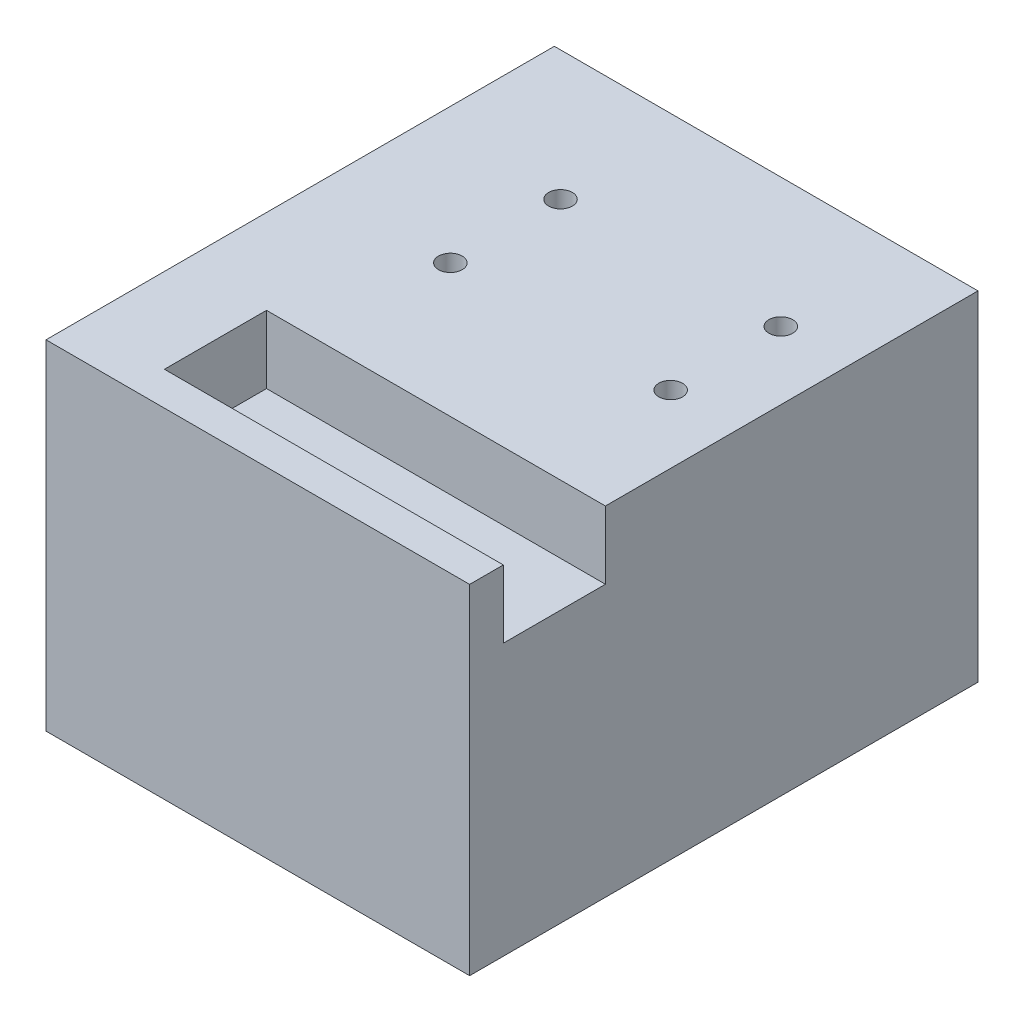
from build123d import *

# Parameters (mm, degrees)
SKETCH2_W           = 80
SKETCH2_H           = 100
BOSS_EXTRUDE1_DEPTH = 40
SKETCH3_W           = 40
SKETCH3_H           = 12.05
CUT_EXTRUDE1_DEPTH  = 8
SKETCH5_R           = 1.4
CUT_EXTRUDE2_DEPTH  = 2
SKETCH8_W           = 100
SKETCH8_H           = 40
CUT_EXTRUDE5_DEPTH  = 30
SKETCH9_W           = 50
SKETCH9_H           = 40
CUT_EXTRUDE6_DEPTH  = 40


with BuildPart() as part:
    # Sketch2 → Boss-Extrude1 (new body)
    with BuildSketch(Plane(origin=(0, 0, 0), x_dir=(1, 0, 0), z_dir=(0, 1, 0))):
        Rectangle(SKETCH2_W, SKETCH2_H)
    extrude(amount=BOSS_EXTRUDE1_DEPTH)

    # Sketch3 → Cut-Extrude1 (cut)
    with BuildSketch(Plane(origin=(0, 40, 0), x_dir=(1, 0, 0), z_dir=(0, 1, 0))):
        with Locations((20, 0)):
            Rectangle(SKETCH3_W, SKETCH3_H)
    extrude(amount=-CUT_EXTRUDE1_DEPTH, mode=Mode.SUBTRACT)

    # Sketch5 → Cut-Extrude2 (cut)
    with BuildSketch(Plane(origin=(0, 40, 0), x_dir=(1, 0, 0), z_dir=(0, 1, 0))):
        with Locations(Location((6, 21.725, 0), (0, 0, 270))):
            Circle(SKETCH5_R)
        with Locations(Location((32, 21.725, 0), (0, 0, 270))):
            Circle(SKETCH5_R)
        with Locations(Location((32, 34.725, 0), (0, 0, 270))):
            Circle(SKETCH5_R)
        with Locations(Location((6, 34.725, 0), (0, 0, 270))):
            Circle(SKETCH5_R)
    extrude(amount=-CUT_EXTRUDE2_DEPTH, mode=Mode.SUBTRACT)

    # Sketch8 → Cut-Extrude5 (cut)
    with BuildSketch(Plane.ZY.offset(40)):
        with Locations((0, 20)):
            Rectangle(SKETCH8_W, SKETCH8_H)
    extrude(amount=-CUT_EXTRUDE5_DEPTH, mode=Mode.SUBTRACT)

    # Sketch9 → Cut-Extrude6 (cut)
    with BuildSketch(Plane.XY.offset(50)):
        with Locations((15, 20)):
            Rectangle(SKETCH9_W, SKETCH9_H)
    extrude(amount=-CUT_EXTRUDE6_DEPTH, mode=Mode.SUBTRACT)


solid = part.part
